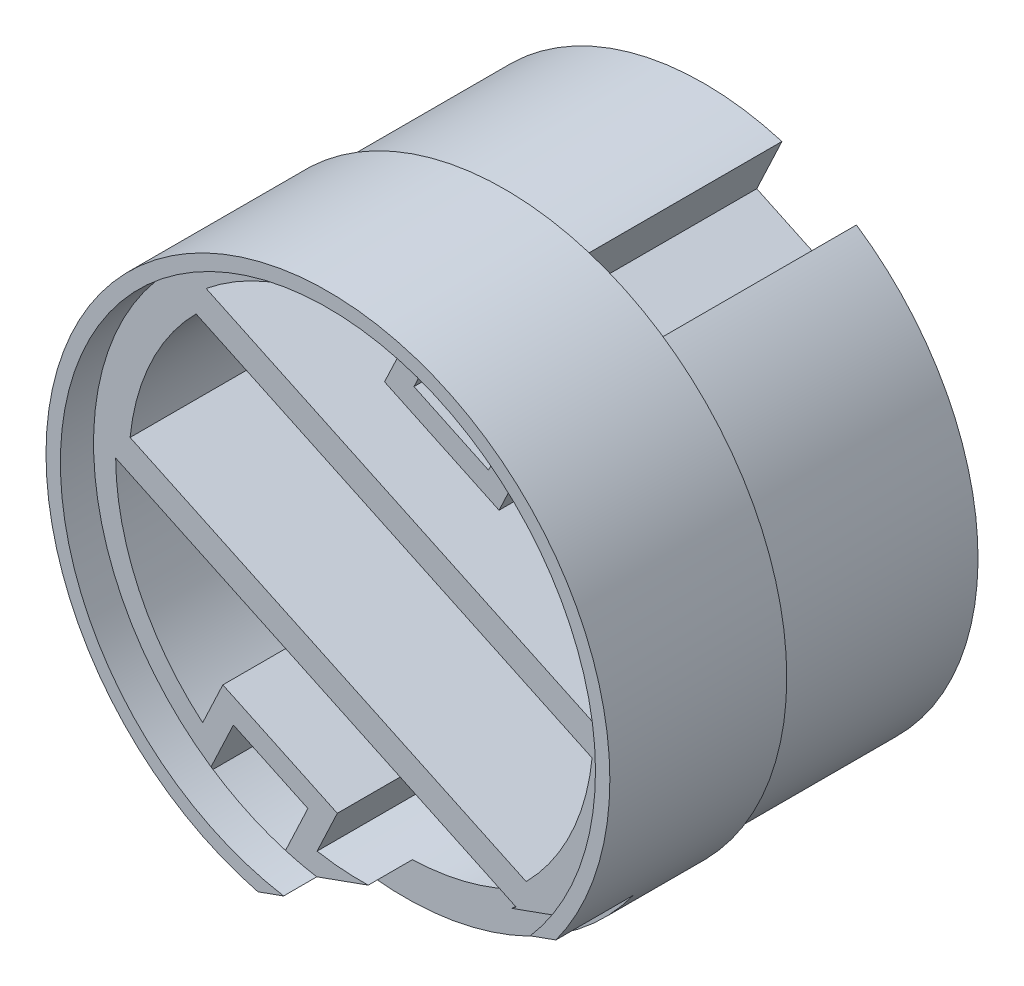
from build123d import *

# Parameters (mm, degrees)
SKETCH_1_R          = 12.4
EXTRUDE_1_DEPTH     = 17
SKETCH_2_R          = 12.1
CUT_EXTRUDE_1_DEPTH = 1.5
CUT_EXTRUDE_2_DEPTH = 24.404486749
EXTRUDE_START       = -8
SKETCH_4_R          = 12.75
SKETCH_4_R_2        = 12.4
EXTRUDE_2_DEPTH     = 8
CUT_EXTRUDE_3_DEPTH = 14.5
CUT_EXTRUDE_4_DEPTH = 24.777615524
CUT_EXTRUDE_START   = -3.5
CUT_EXTRUDE_5_DEPTH = 3.5


with BuildPart() as part:
    # 草图1 → 凸台-拉伸1 (new body)
    with BuildSketch(Plane.XY):
        Circle(SKETCH_1_R)
    extrude(amount=EXTRUDE_1_DEPTH)

    # 草图2 → 切除-拉伸1 (cut)
    with BuildSketch(Plane.XY.offset(17)):
        Circle(SKETCH_2_R)
    extrude(amount=-CUT_EXTRUDE_1_DEPTH, mode=Mode.SUBTRACT)

    # 草图3 → 切除-拉伸2 (cut, through all)
    with BuildSketch(Plane.XY.offset(15.5)):
        with BuildLine():
            Line((-6.915466109, -10.292537515), (-5.774584306, -7.870847726))
            Line((-5.774584306, -7.870847726), (-2.405724389, -9.457950665))
            Line((-2.405724389, -9.457950665), (-3.547574837, -11.881696544))
            ThreePointArc((-3.547574837, -11.881696544), (-5.291518031, -11.214269345), (-6.915466109, -10.292537515))
        make_face()
        with BuildLine():
            Line((5.761046975, 7.877225296), (6.902897424, 10.300971175))
            ThreePointArc((6.902897424, 10.300971175), (5.277825448, 11.220720055), (3.533068862, 11.886018022))
            Line((3.533068862, 11.886018022), (2.392187058, 9.464328234))
            Line((2.392187058, 9.464328234), (5.761046975, 7.877225296))
        make_face()
    extrude(amount=-CUT_EXTRUDE_2_DEPTH, mode=Mode.SUBTRACT)

    # 草图4 → 凸台-拉伸2 (add)
    with BuildSketch(Plane.XY.offset(17).offset(EXTRUDE_START)):
        Circle(SKETCH_4_R)
        Circle(SKETCH_4_R_2, mode=Mode.SUBTRACT)
    extrude(amount=EXTRUDE_2_DEPTH)

    # 草图5 → 切除-拉伸3 (cut)
    with BuildSketch(Plane.XY.offset(15.5)):
        with BuildLine():
            Line((-7.463806301, 7.385228195), (10.44708929, -1.05277033))
            ThreePointArc((10.44708929, -1.05277033), (9.498686797, -4.474924483), (7.463806301, -7.385228195))
            Line((7.463806301, -7.385228195), (-10.44708929, 1.05277033))
            ThreePointArc((-10.44708929, 1.05277033), (-9.498686797, 4.474924483), (-7.463806301, 7.385228195))
        make_face()
    extrude(amount=-CUT_EXTRUDE_3_DEPTH, mode=Mode.SUBTRACT)

    # 草图6 → 切除-拉伸4 (cut, through all)
    with BuildSketch(Plane.XY.offset(15.5)):
        with BuildLine():
            Line((11.09973429, 0.076802961), (-7.008374763, 8.607710682))
            ThreePointArc((-7.008374763, 8.607710682), (-2.770642176, 10.748653029), (1.973996084, 10.923064564))
            Line((1.973996084, 10.923064564), (1.061366936, 8.98587468))
            Line((1.061366936, 8.98587468), (6.239500529, 6.546405174))
            Line((6.239500529, 6.546405174), (7.153831598, 8.487207636))
            ThreePointArc((7.153831598, 8.487207636), (10.048974754, 4.714669277), (11.09973429, 0.076802961))
        make_face()
        with BuildLine():
            Line((7.008374763, -8.607710682), (-11.09973429, -0.076802961))
            ThreePointArc((-11.09973429, -0.076802961), (-10.052261546, -4.707657359), (-7.165667007, -8.477217488))
            Line((-7.165667007, -8.477217488), (-6.253037859, -6.540027604))
            Line((-6.253037859, -6.540027604), (-1.074904267, -8.979497111))
            Line((-1.074904267, -8.979497111), (-1.989235336, -10.920299574))
            ThreePointArc((-1.989235336, -10.920299574), (2.763142593, -10.75058338), (7.008374763, -8.607710682))
        make_face()
    extrude(amount=-CUT_EXTRUDE_4_DEPTH, mode=Mode.SUBTRACT)

    # 草图7 → 切除-拉伸5 (cut)
    with BuildSketch(Plane.XY.offset(17).offset(CUT_EXTRUDE_START)):
        with BuildLine():
            Line((-3.16472158, -12.350993374), (10.31093311, -7.499810558))
            ThreePointArc((10.31093311, -7.499810558), (4.318631553, -11.996329502), (-3.16472158, -12.350993374))
        make_face()
    extrude(amount=CUT_EXTRUDE_5_DEPTH, mode=Mode.SUBTRACT)


solid = part.part
